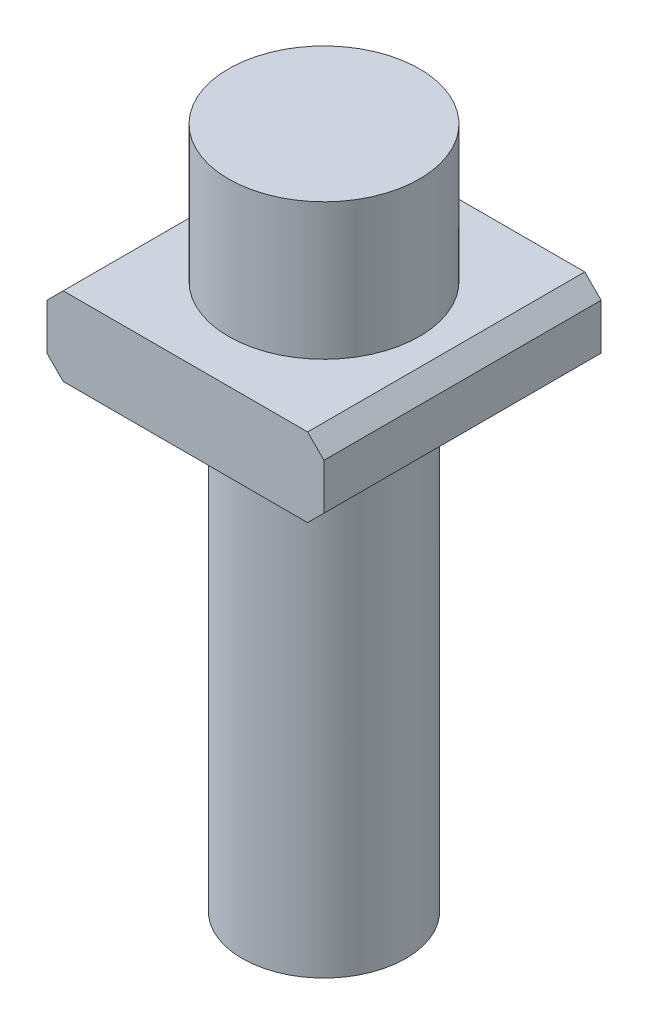
from build123d import *

# Parameters (mm, degrees)
SKETCH1_W           = 5.08
SKETCH1_H           = 5.08
BOSS_EXTRUDE1_DEPTH = 1.44
SKETCH2_R           = 1.5
BOSS_EXTRUDE2_DEPTH = 10
SKETCH3_R           = 1.75
BOSS_EXTRUDE3_DEPTH = 2.5
CHAMFER1_SIZE       = 0.3


with BuildPart() as part:
    # Sketch1 → Boss-Extrude1 (new body)
    with BuildSketch(Plane(origin=(0, 0, 0), x_dir=(1, 0, 0), z_dir=(0, 1, 0))):
        Rectangle(SKETCH1_W, SKETCH1_H)
    extrude(amount=BOSS_EXTRUDE1_DEPTH)

    # Sketch2 → Boss-Extrude2 (add)
    with BuildSketch(Plane.XZ.offset(-1.44)):
        with Locations(Location((0, 0, 0), (0, 0, 90))):
            Circle(SKETCH2_R)
    extrude(amount=BOSS_EXTRUDE2_DEPTH)

    # Sketch3 → Boss-Extrude3 (add)
    with BuildSketch(Plane(origin=(0, 1.44, 0), x_dir=(1, 0, 0), z_dir=(0, 1, 0))):
        with Locations(Location((0, 0, 0), (0, 0, 270))):
            Circle(SKETCH3_R)
    extrude(amount=BOSS_EXTRUDE3_DEPTH)

    # Chamfer1
    chamfer1_edges = [part.edges().sort_by_distance(p)[0] for p in [
        (2.54, 1.44, 0),
        (-2.54, 1.44, 0),
        (2.54, 0, 0),
        (-2.54, 0, 0),
    ]]
    chamfer(chamfer1_edges, length=CHAMFER1_SIZE)


solid = part.part
